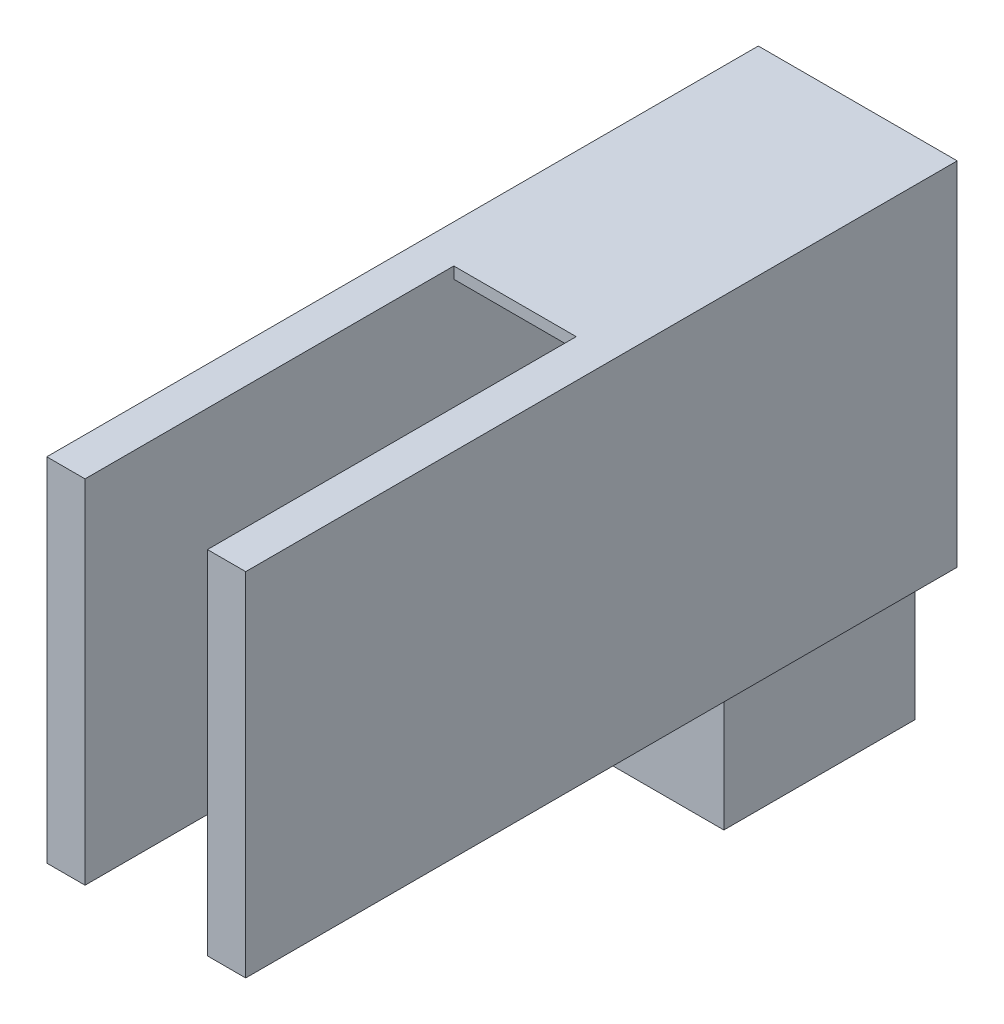
from build123d import *

# Parameters (mm, degrees)
SKETCH_2_W          = 26
SKETCH_2_H          = 46
EXTRUDE_1_DEPTH     = 93
CUT_EXTRUDE_1_DEPTH = 8
SKETCH_7_W          = 25
SKETCH_7_H          = 20
EXTRUDE_2_DEPTH     = 7.5


with BuildPart() as part:
    # 스케치2 → 보스-돌출1 (new body)
    with BuildSketch(Plane.XY):
        Rectangle(SKETCH_2_W, SKETCH_2_H)
    extrude(amount=EXTRUDE_1_DEPTH)

    # 스케치3 → 컷-돌출1 (cut, symmetric)
    with BuildSketch(Plane(origin=(0, 0, 0), x_dir=(0, 0, -1), z_dir=(1, 0, 0))):
        Polygon((-93, -23), (-20, -23), (-20, 21.5), (-44.8, 21.5), (-44.8, 23), (-93, 23), align=None)
    extrude(amount=CUT_EXTRUDE_1_DEPTH, both=True, mode=Mode.SUBTRACT)

    # 스케치7 → 보스-돌출2 (add, symmetric)
    with BuildSketch(Plane(origin=(0, 0, 0), x_dir=(0, 0, -1), z_dir=(1, 0, 0))):
        with Locations((-12.5, -33)):
            Rectangle(SKETCH_7_W, SKETCH_7_H)
    extrude(amount=EXTRUDE_2_DEPTH, both=True)


solid = part.part
